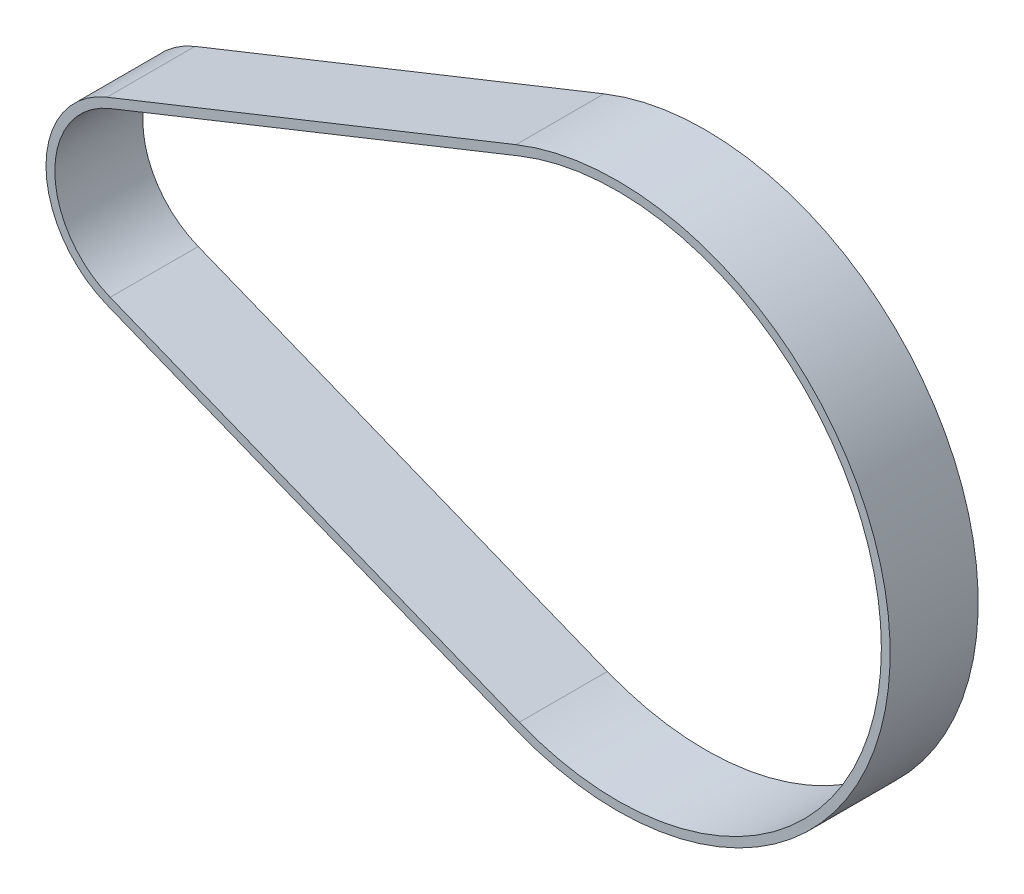
from build123d import *

# Parameters (mm, degrees)
EXTRUDE_1_DEPTH = 10


with BuildPart() as part:
    # 草图1 → 拉伸1 (new body)
    with BuildSketch(Plane.XY):
        with BuildLine():
            Line((-57.981632653, 10.214708752), (-11.502782931, 28.786906483))
            ThreePointArc((-11.502782931, 28.786906483), (31, 0), (-11.502782931, -28.786906483))
            Line((-11.502782931, -28.786906483), (-57.981632653, -10.214708752))
            ThreePointArc((-57.981632653, -10.214708752), (-64.9, 0), (-57.981632653, 10.214708752))
        make_face()
        with BuildLine():
            Line((-57.610575139, 9.286098865), (-11.131725417, 27.858296596))
            ThreePointArc((-11.131725417, 27.858296596), (30, 0), (-11.131725417, -27.858296596))
            Line((-11.131725417, -27.858296596), (-57.610575139, -9.286098865))
            ThreePointArc((-57.610575139, -9.286098865), (-63.9, 0), (-57.610575139, 9.286098865))
        make_face(mode=Mode.SUBTRACT)
    extrude(amount=EXTRUDE_1_DEPTH)


solid = part.part
